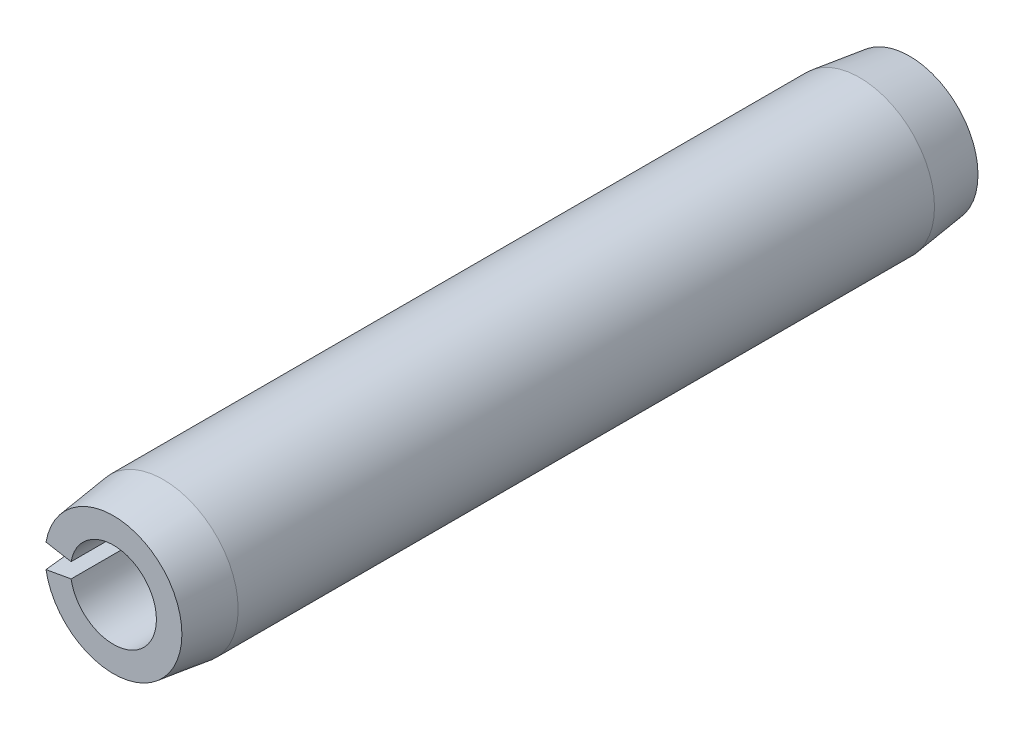
from build123d import *

# Parameters (mm, degrees)
EXTRUDE1_DEPTH      = 12.7
EXTRUDE1_DEPTH_BACK = 12.7


with BuildPart() as part:
    # Sketch1 → Extrude1 (new, two sides: drawn at the far end of the back side and taken through both)
    with BuildSketch(Plane.XY.offset(-EXTRUDE1_DEPTH_BACK)):
        with BuildLine():
            Line((-1.350762314, -0.23817584), (-2.351326991, -0.414602389))
            ThreePointArc((-2.351326991, -0.414602389), (2.3876, 0), (-2.351326991, 0.414602389))
            Line((-2.351326991, 0.414602389), (-1.350762314, 0.23817584))
            ThreePointArc((-1.350762314, 0.23817584), (1.3716, 0), (-1.350762314, -0.23817584))
        make_face()
    extrude(amount=EXTRUDE1_DEPTH + EXTRUDE1_DEPTH_BACK)

    # Sketch2 → Cut-Revolve1 (revolve, cut)
    with BuildSketch(Plane(origin=(0, 0, 0), x_dir=(0, 0, -1), z_dir=(1, 0, 0))):
        Polygon((12.7, 2.1844), (11.108266667, 2.3876), (12.7, 2.3876), align=None)
    cut_revolve1 = revolve(axis=Axis((0, 0, -12.7), (0, 0, 1)), mode=Mode.SUBTRACT)

    # Mirror1: Cut-Revolve1 across plane
    add(cut_revolve1.mirror(Plane.XY), mode=Mode.SUBTRACT)


solid = part.part
